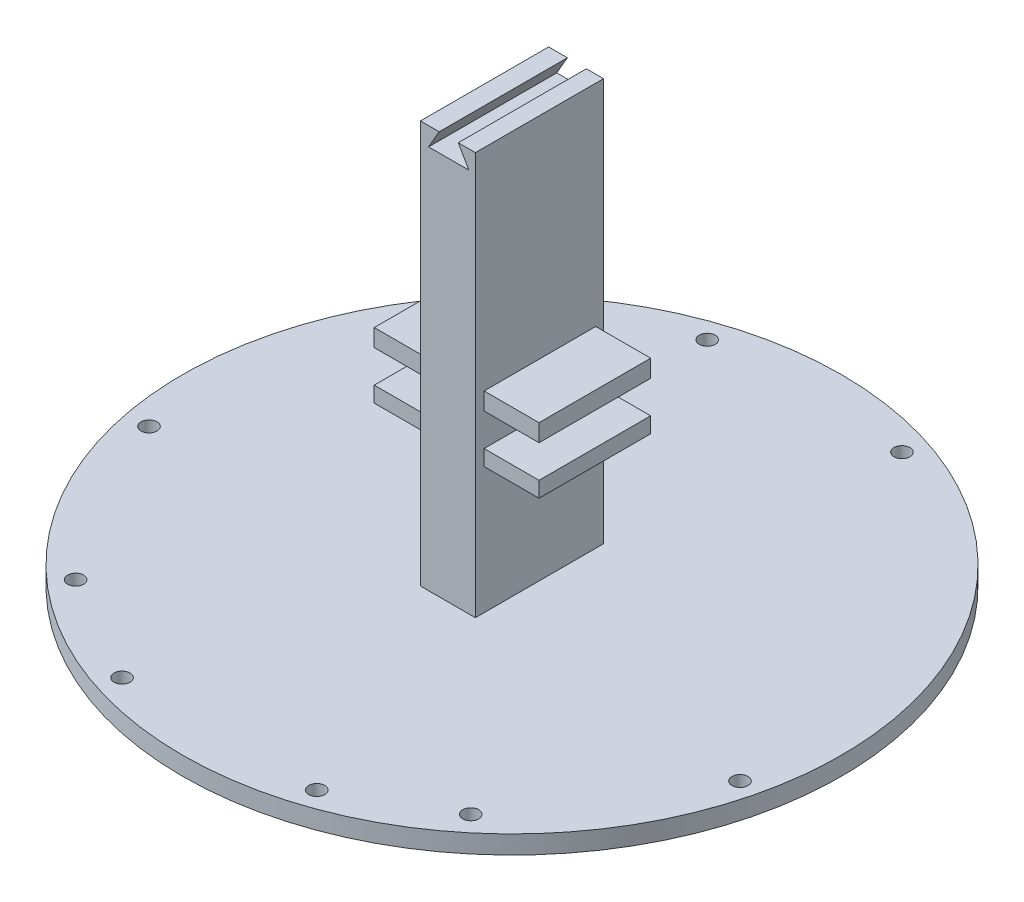
from build123d import *

# Parameters (mm, degrees)
SKETCH1_R                = 90
BOSS_EXTRUDE1_DEPTH      = 5
SKETCH2_W                = 15
SKETCH2_H                = 35
BOSS_EXTRUDE2_DEPTH      = 110
CUT_EXTRUDE1_DEPTH       = 36
SKETCH4_R                = 2.18255
CUT_EXTRUDE2_DEPTH       = 62
BOSS_EXTRUDE4_DEPTH      = 15
BOSS_EXTRUDE4_DEPTH_BACK = 30
SKETCH6_W                = 30.491916349
SKETCH6_H                = 4.74874107
SKETCH6_H_2              = 4.248873589


with BuildPart() as part:
    # Sketch1 → Boss-Extrude1 (new body)
    with BuildSketch(Plane(origin=(0, 0, 0), x_dir=(1, 0, 0), z_dir=(0, 1, 0))):
        with Locations(Location((0, 0, 0), (0, 0, 270))):
            Circle(SKETCH1_R)
    extrude(amount=BOSS_EXTRUDE1_DEPTH)

    # Sketch2 → Boss-Extrude2 (add)
    with BuildSketch(Plane(origin=(0, 5, 0), x_dir=(1, 0, 0), z_dir=(0, 1, 0))):
        Rectangle(SKETCH2_W, SKETCH2_H)
    extrude(amount=BOSS_EXTRUDE2_DEPTH)

    # Sketch3 → Cut-Extrude1 (cut)
    with BuildSketch(Plane.XY.offset(17.5)):
        Polygon((-2.373551685, 115), (2.826448315, 115), (5.726448315, 109.977052658), (-5.273551685, 109.977052658), align=None)
    extrude(amount=-CUT_EXTRUDE1_DEPTH, mode=Mode.SUBTRACT)

    # Sketch4 → Cut-Extrude2 (cut)
    with BuildSketch(Plane(origin=(0, 0, 0), x_dir=(-1, 0, 0), z_dir=(0, -1, 0))):
        with Locations(Location((-26.585, 79.907325251, 0), (0, 0, 90))):
            Circle(SKETCH4_R)
        with Locations(Location((26.585, 79.907325251, 0), (0, 0, 90))):
            Circle(SKETCH4_R)
        with Locations(Location((82.310329065, -16.825152102, 0), (0, 0, 90))):
            Circle(SKETCH4_R)
        with Locations(Location((56.093218167, -63.082173149, 0), (0, 0, 90))):
            Circle(SKETCH4_R)
        with Locations(Location((26.585, -79.907325251, 0), (0, 0, 90))):
            Circle(SKETCH4_R)
        with Locations(Location((-26.585, -79.907325251, 0), (0, 0, 90))):
            Circle(SKETCH4_R)
        with Locations(Location((-53.346563788, -64.612502947, 0), (0, 0, 90))):
            Circle(SKETCH4_R)
        with Locations(Location((-82.245302282, -19.978089739, 0), (0, 0, 90))):
            Circle(SKETCH4_R)
    extrude(amount=-CUT_EXTRUDE2_DEPTH, mode=Mode.SUBTRACT)

    # Sketch6 → Boss-Extrude4 (add, two sides: drawn at the far end of the back side and taken through both)
    with BuildSketch(Plane(origin=(7.5, 0, 0), x_dir=(0, 0, -1), z_dir=(1, 0, 0)).offset(-BOSS_EXTRUDE4_DEPTH_BACK)):
        with Locations((0.124966871, 55.070581362)):
            Rectangle(SKETCH6_W, SKETCH6_H)
        with Locations((0.124966871, 41.699126242)):
            Rectangle(SKETCH6_W, SKETCH6_H_2)
    extrude(amount=BOSS_EXTRUDE4_DEPTH + BOSS_EXTRUDE4_DEPTH_BACK)


solid = part.part
